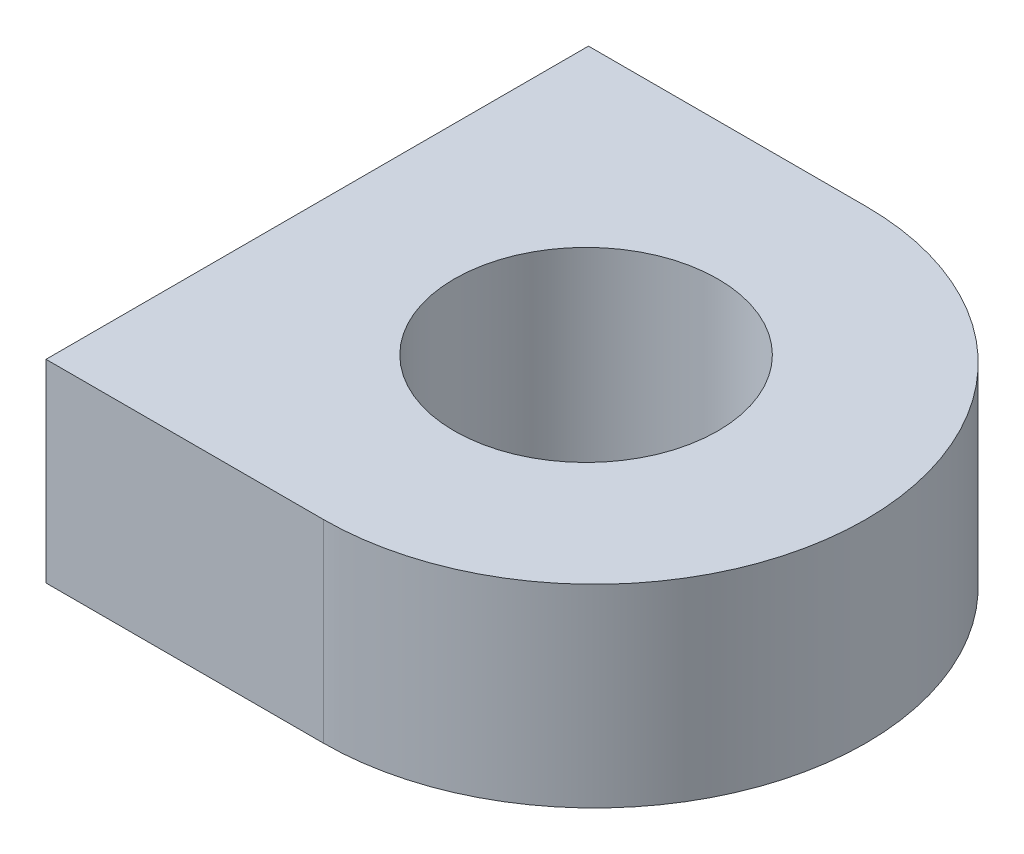
from build123d import *

# Parameters (mm, degrees)
SKETCH1_R           = 1.7
BOSS_EXTRUDE2_DEPTH = 2.5


with BuildPart() as part:
    # Sketch1 → Boss-Extrude2 (new body)
    with BuildSketch(Plane(origin=(0, 0, 0), x_dir=(1, 0, 0), z_dir=(0, 1, 0))):
        with BuildLine():
            Line((-3.435794878, -0.033363683), (-3.435794878, 3.466636317))
            Line((-3.435794878, 3.466636317), (0.143666226, 3.466636317))
            ThreePointArc((0.143666226, 3.466636317), (3.643666226, -0.033363683), (0.143666226, -3.533363683))
            Line((0.143666226, -3.533363683), (-3.435794878, -3.533363683))
            Line((-3.435794878, -3.533363683), (-3.435794878, -0.033363683))
        make_face()
        with Locations(Location((0, 0, 0), (0, 0, 270))):
            Circle(SKETCH1_R, mode=Mode.SUBTRACT)
    extrude(amount=BOSS_EXTRUDE2_DEPTH)


solid = part.part
